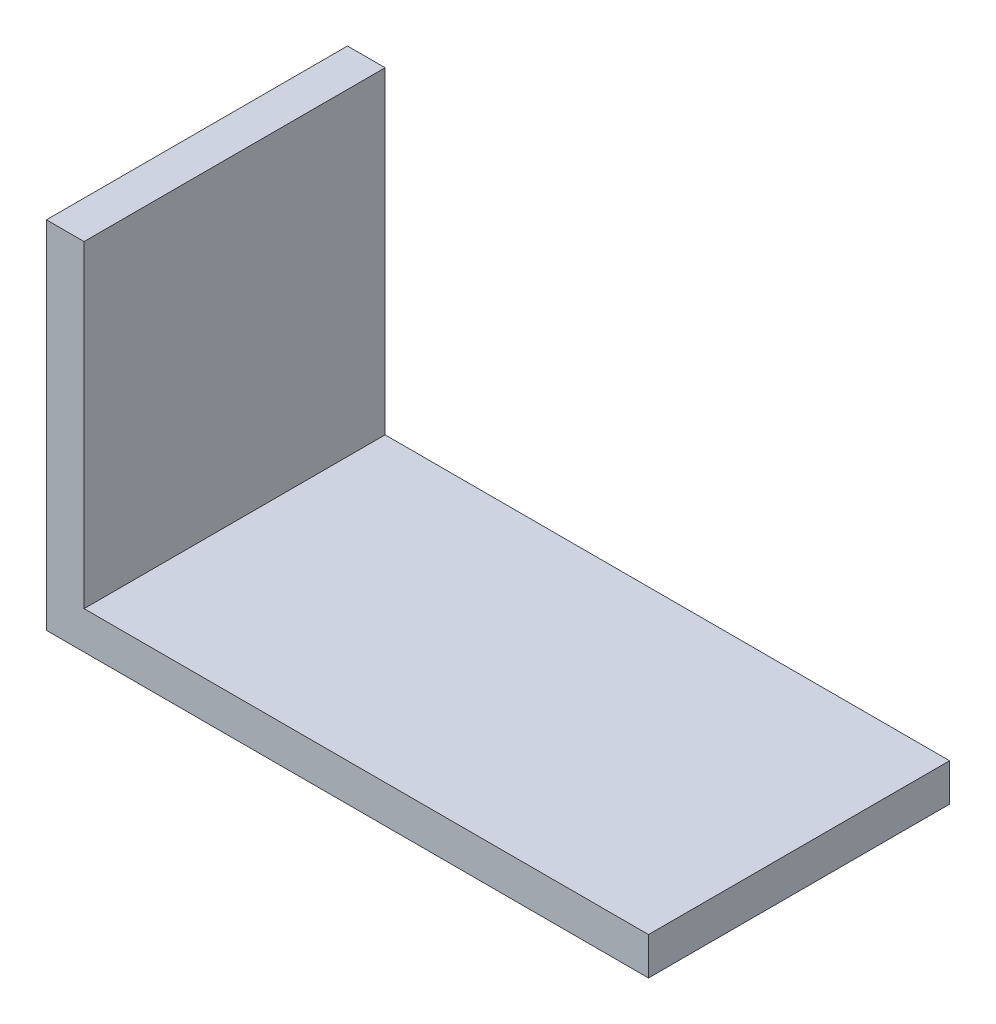
from build123d import *

# Parameters (mm, degrees)
BOSS_EXTRUDE1_DEPTH = 25.4


with BuildPart() as part:
    # Sketch1 → Boss-Extrude1 (new body)
    with BuildSketch(Plane.XY):
        Polygon((0, 0), (0, 30), (3.175, 30), (3.175, 3.175), (50.8, 3.175), (50.8, 0), align=None)
    extrude(amount=BOSS_EXTRUDE1_DEPTH)


solid = part.part
